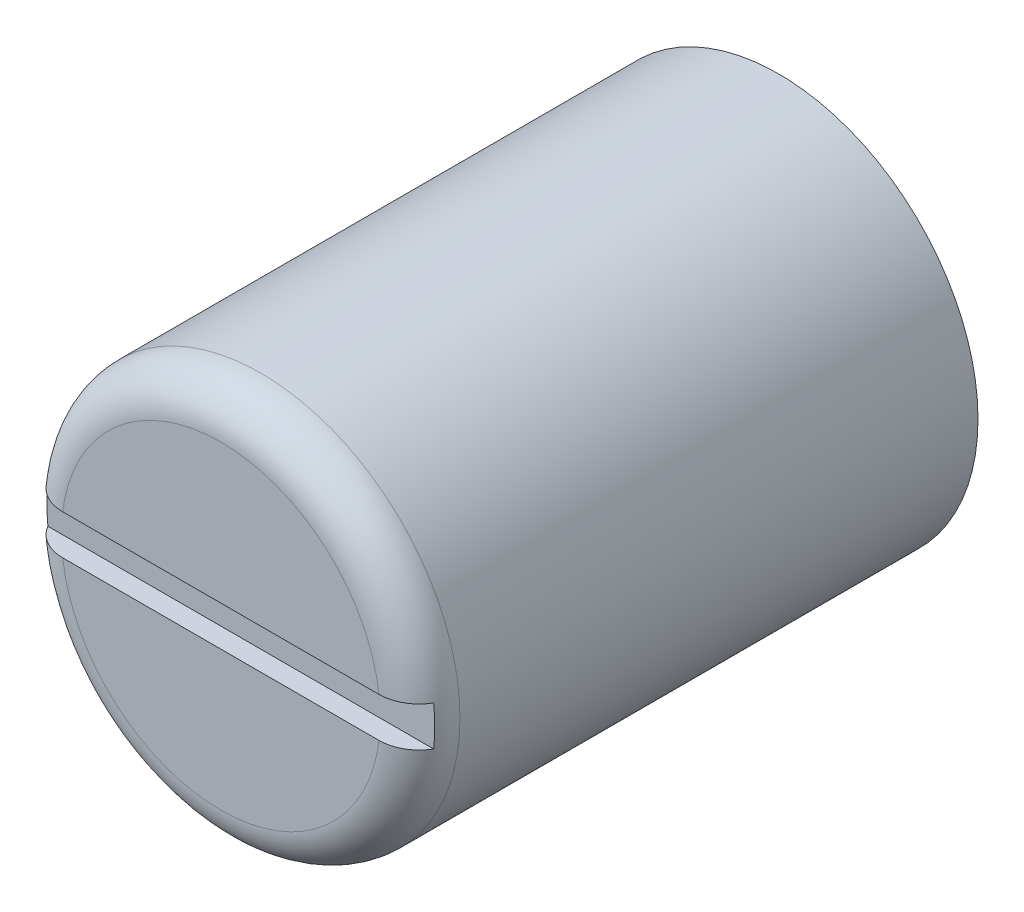
from build123d import *

# Parameters (mm, degrees)
BOSS_EXTRUDE1_START = 1
SKETCH1_R           = 5
BOSS_EXTRUDE1_DEPTH = 14
CUT_EXTRUDE1_START  = -1.5
SKETCH2_W           = 2.15
SKETCH2_H           = 6.2
CUT_EXTRUDE1_DEPTH  = 15
FILLET2_R           = 1
SKETCH3_W           = 10
SKETCH3_H           = 1
CUT_EXTRUDE2_DEPTH  = 0.5


with BuildPart() as part:
    # Sketch1 → Boss-Extrude1 (new body)
    with BuildSketch(Plane.XY.offset(BOSS_EXTRUDE1_START)):
        with Locations((15.441970815, -61.974353767)):
            Circle(SKETCH1_R)
    extrude(amount=BOSS_EXTRUDE1_DEPTH)

    # Sketch2 → Cut-Extrude1 (cut)
    with BuildSketch(Plane.XY.offset(15).offset(CUT_EXTRUDE1_START)):
        with Locations((15.441970815, -61.974353767)):
            Rectangle(SKETCH2_W, SKETCH2_H)
    extrude(amount=-CUT_EXTRUDE1_DEPTH, mode=Mode.SUBTRACT)

    # Fillet2
    fillet2_edges = [part.edges().sort_by_distance(p)[0] for p in [
        (10.441970815, -61.974353767, 15),
    ]]
    fillet(fillet2_edges, radius=FILLET2_R)

    # Sketch3 → Cut-Extrude2 (cut)
    with BuildSketch(Plane.XY.offset(15)):
        with Locations((15.441970815, -61.974353767)):
            Rectangle(SKETCH3_W, SKETCH3_H)
    extrude(amount=-CUT_EXTRUDE2_DEPTH, mode=Mode.SUBTRACT)


solid = part.part
